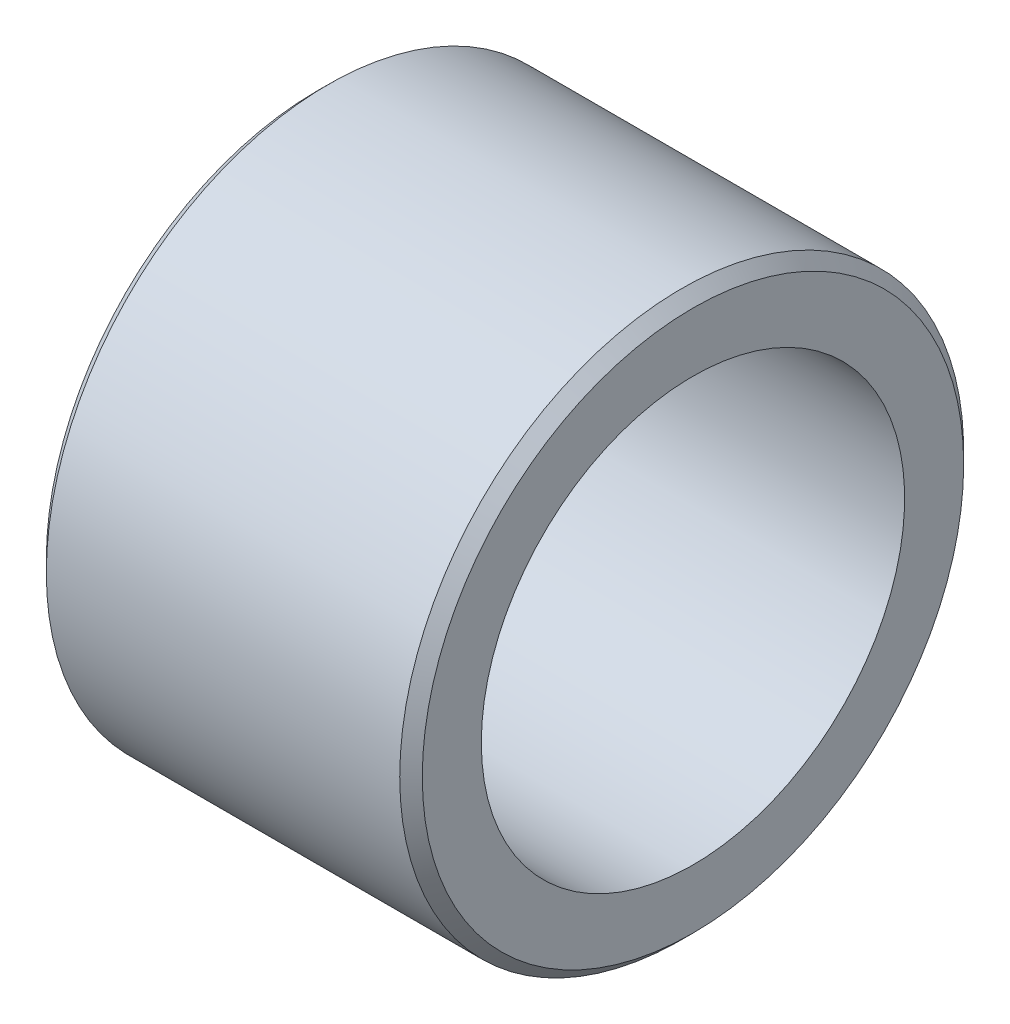
from build123d import *

# Parameters (mm, degrees)
PRIMARY_SKETCH_W  = 12.7
PRIMARY_SKETCH_H  = 2.3749
EDGE_CHAMFER_SIZE = 0.381


with BuildPart() as part:
    # Primary Sketch → Primary Revolve (revolve)
    with BuildSketch(Plane.XY, mode=Mode.PRIVATE) as primary_revolve_sk:
        with Locations((6.35, 8.33755)):
            Rectangle(PRIMARY_SKETCH_W, PRIMARY_SKETCH_H)
    revolve(primary_revolve_sk.sketch.rotate(Axis((0, 0, 0), (1, 0, 0)), 90), axis=Axis((0, 0, 0), (1, 0, 0)))

    # Edge Chamfer
    edge_chamfer_edges = [part.edges().sort_by_distance(p)[0] for p in [
        (12.7, 0, -9.525),
        (0, 0, -9.525),
    ]]
    chamfer(edge_chamfer_edges, length=EDGE_CHAMFER_SIZE)


solid = part.part
